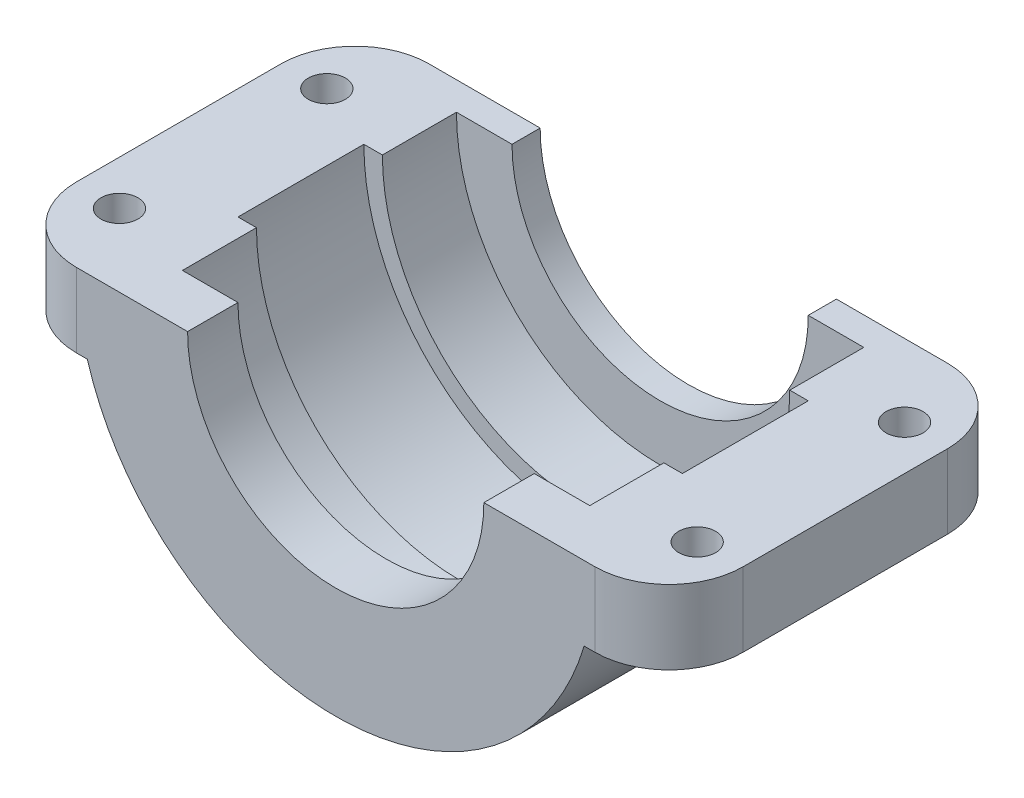
from build123d import *

# Parameters (mm, degrees)
CROQUIS1_R              = 35
SALIENTE_EXTRUIR1_DEPTH = 47.6
CROQUIS2_W              = 81.100238634
CROQUIS2_H              = 55.229590233
CORTAR_EXTRUIR1_DEPTH   = 69.671391423
CROQUIS3_W              = 90
CROQUIS3_H              = 10
SALIENTE_EXTRUIR2_DEPTH = 47.6
CROQUIS4_R              = 2.5
CORTAR_EXTRUIR2_DEPTH   = 75.268162762
CROQUIS5_R              = 20
CORTAR_EXTRUIR3_DEPTH   = 75.268162762
REDONDEO1_R             = 10
CORTAR_EXTRUIR4_START   = -6.8
CROQUIS6_R              = 27.5
CORTAR_EXTRUIR4_DEPTH   = 37
CORTAR_EXTRUIR5_START   = 10
CROQUIS7_R              = 30
CORTAR_EXTRUIR5_DEPTH   = 17


with BuildPart() as part:
    # Croquis1 → Saliente-Extruir1 (new body)
    with BuildSketch(Plane.XY):
        Circle(CROQUIS1_R)
    extrude(amount=SALIENTE_EXTRUIR1_DEPTH)

    # Croquis2 → Cortar-Extruir1 (cut, through all)
    with BuildSketch(Plane.XY.offset(47.6)):
        with Locations((5.550119317, 27.614795117)):
            Rectangle(CROQUIS2_W, CROQUIS2_H)
    extrude(amount=-CORTAR_EXTRUIR1_DEPTH, mode=Mode.SUBTRACT)

    # Croquis3 → Saliente-Extruir2 (add)
    with BuildSketch(Plane.XY.offset(47.6)):
        with Locations((0, -5)):
            Rectangle(CROQUIS3_W, CROQUIS3_H)
    extrude(amount=-SALIENTE_EXTRUIR2_DEPTH)

    # Croquis4 → Cortar-Extruir2 (cut, through all)
    with BuildSketch(Plane(origin=(0, 0, 0), x_dir=(1, 0, 0), z_dir=(0, 1, 0))):
        with Locations(Location((39, -9.8, 0), (0, 0, 270))):
            Circle(CROQUIS4_R)
        with Locations(Location((39, -37.8, 0), (0, 0, 90))):
            Circle(CROQUIS4_R)
        with Locations(Location((-39, -37.8, 0), (0, 0, 270))):
            Circle(CROQUIS4_R)
        with Locations(Location((-39, -9.8, 0), (0, 0, 90))):
            Circle(CROQUIS4_R)
    extrude(amount=-CORTAR_EXTRUIR2_DEPTH, mode=Mode.SUBTRACT)

    # Croquis5 → Cortar-Extruir3 (cut, through all)
    with BuildSketch(Plane(origin=(0, 0, 0), x_dir=(-1, 0, 0), z_dir=(0, 0, -1))):
        Circle(CROQUIS5_R)
    extrude(amount=-CORTAR_EXTRUIR3_DEPTH, mode=Mode.SUBTRACT)

    # Redondeo1
    redondeo1_edges = [part.edges().sort_by_distance(p)[0] for p in [
        (-45, -5, 47.6),
        (45, -5, 47.6),
        (-45, -5, 0),
        (45, -5, 0),
    ]]
    fillet(redondeo1_edges, radius=REDONDEO1_R)

    # Croquis6 → Cortar-Extruir4 (cut)
    with BuildSketch(Plane.XY.offset(47.6).offset(CORTAR_EXTRUIR4_START)):
        Circle(CROQUIS6_R)
    extrude(amount=-CORTAR_EXTRUIR4_DEPTH, mode=Mode.SUBTRACT)

    # Croquis7 → Cortar-Extruir5 (cut)
    with BuildSketch(Plane(origin=(0, 0, 40.8), x_dir=(-1, 0, 0), z_dir=(0, 0, -1)).offset(CORTAR_EXTRUIR5_START)):
        Circle(CROQUIS7_R)
    extrude(amount=CORTAR_EXTRUIR5_DEPTH, mode=Mode.SUBTRACT)


solid = part.part
